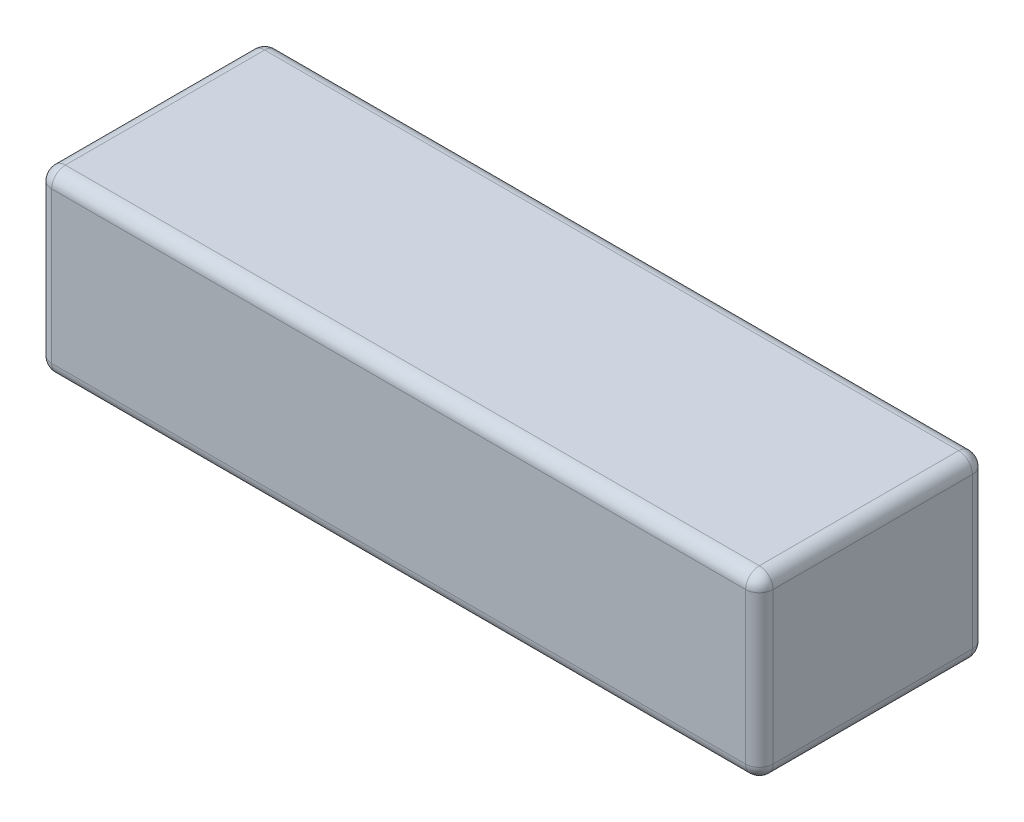
from build123d import *

# Parameters (mm, degrees)
SKETCH_1_W      = 105
SKETCH_1_H      = 33
EXTRUDE_1_DEPTH = 26
FILLET_1_R      = 2


with BuildPart() as part:
    # 草圖1 → 填料-伸長1 (new body)
    with BuildSketch(Plane(origin=(0, 0, 0), x_dir=(1, 0, 0), z_dir=(0, 1, 0))):
        Rectangle(SKETCH_1_W, SKETCH_1_H)
    extrude(amount=EXTRUDE_1_DEPTH)

    # 圓角1
    fillet_1_edges = [part.edges().sort_by_distance(p)[0] for p in [
        (-52.5, 26, 0),
        (0, 26, 16.5),
        (52.5, 26, 0),
        (0, 0, 16.5),
        (-52.5, 0, 0),
        (0, 0, -16.5),
        (52.5, 0, 0),
        (0, 26, -16.5),
        (52.5, 13, 16.5),
        (-52.5, 13, 16.5),
        (-52.5, 13, -16.5),
        (52.5, 13, -16.5),
    ]]
    fillet(fillet_1_edges, radius=FILLET_1_R)


solid = part.part
